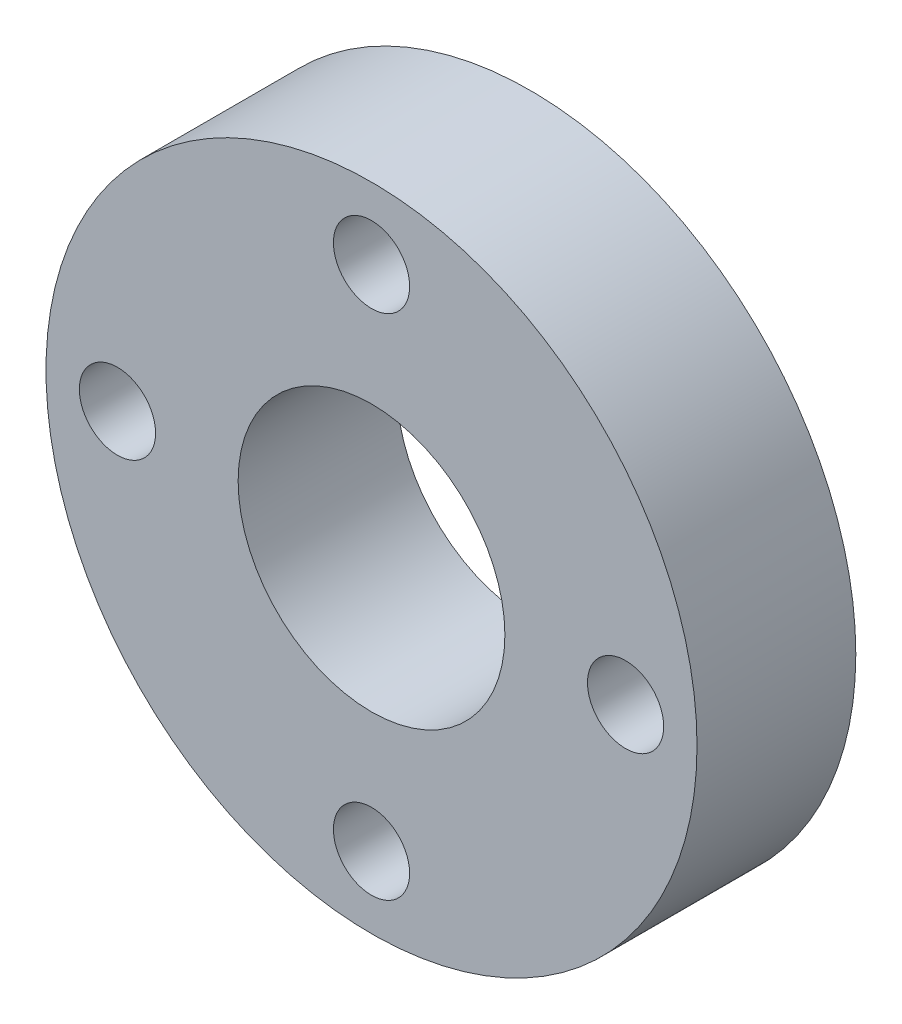
from build123d import *

# Parameters (mm, degrees)
SKETCH1_R           = 10.25
SKETCH1_R_2         = 4.2
SKETCH1_R_3         = 1.2
BOSS_EXTRUDE1_DEPTH = 5


with BuildPart() as part:
    # Sketch1 → Boss-Extrude1 (new body)
    with BuildSketch(Plane.XY):
        Circle(SKETCH1_R)
        Circle(SKETCH1_R_2, mode=Mode.SUBTRACT)
        with Locations((0, 8)):
            Circle(SKETCH1_R_3, mode=Mode.SUBTRACT)
        with Locations((8, 0)):
            Circle(SKETCH1_R_3, mode=Mode.SUBTRACT)
        with Locations((0, -8)):
            Circle(SKETCH1_R_3, mode=Mode.SUBTRACT)
        with Locations((-8, 0)):
            Circle(SKETCH1_R_3, mode=Mode.SUBTRACT)
    extrude(amount=BOSS_EXTRUDE1_DEPTH)


solid = part.part
